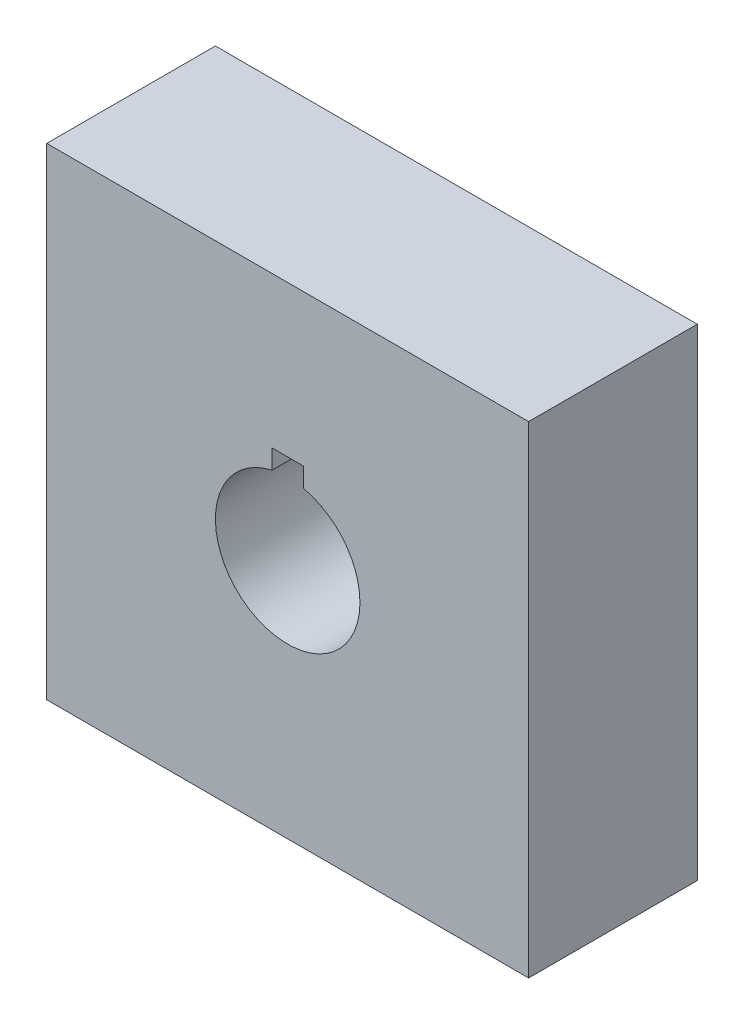
from build123d import *

# Parameters (mm, degrees)
BOSS_EXTRUDE1_DEPTH = 35
SKETCH2_R           = 15
CUT_EXTRUDE1_DEPTH  = 50


with BuildPart() as part:
    # Sketch1 → Boss-Extrude1 (new body)
    with BuildSketch(Plane.XY):
        Polygon((24.650973025, 50), (50, 50), (50, -50), (-50, -50), (-50, 50), align=None)
    extrude(amount=BOSS_EXTRUDE1_DEPTH)

    # Sketch2 → Cut-Extrude1 (cut)
    with BuildSketch(Plane.XY.offset(35)):
        Circle(SKETCH2_R)
        with BuildLine():
            Line((3.235, 18.647005667), (-3.235, 18.647005667))
            Line((-3.235, 18.647005667), (-3.235, 14.647005667))
            ThreePointArc((-3.235, 14.647005667), (0, 15), (3.235, 14.647005667))
            Line((3.235, 14.647005667), (3.235, 18.647005667))
        make_face()
    extrude(amount=-CUT_EXTRUDE1_DEPTH, mode=Mode.SUBTRACT)


solid = part.part
